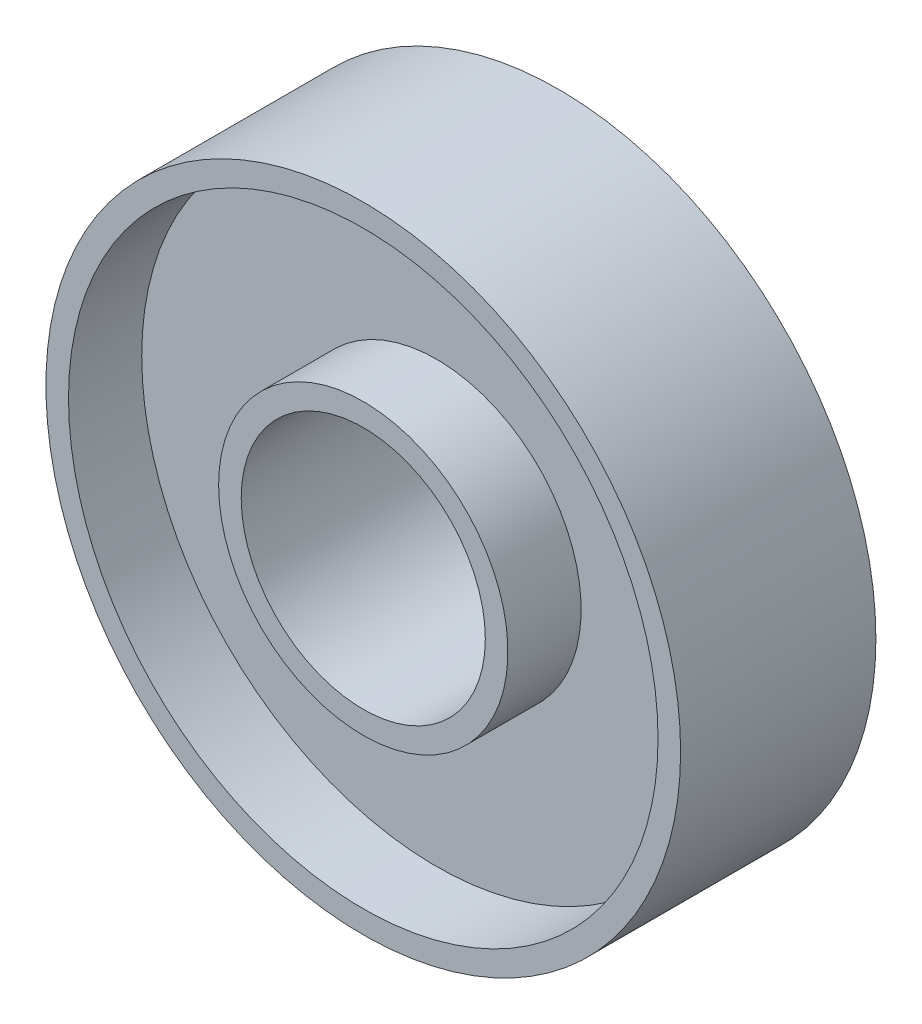
from build123d import *

# Parameters (mm, degrees)
SKETCH2_R                = 13
SKETCH2_R_2              = 12.075
BOSS_EXTRUDE1_DEPTH      = 8
BOSS_EXTRUDE2_DEPTH      = 1
BOSS_EXTRUDE2_DEPTH_BACK = 1
SKETCH3_R                = 12.569499656
BOSS_EXTRUDE3_DEPTH      = 4
BOSS_EXTRUDE3_DEPTH_BACK = 4
SKETCH5_R                = 5.925
SKETCH5_R_2              = 5
SKETCH6_R                = 5
CUT_EXTRUDE1_DEPTH       = 2


with BuildPart() as part:
    # Sketch2 → Boss-Extrude1 (new body)
    with BuildSketch(Plane.XY):
        Circle(SKETCH2_R)
        Circle(SKETCH2_R_2, mode=Mode.SUBTRACT)
    extrude(amount=BOSS_EXTRUDE1_DEPTH)

    # Sketch3 → Boss-Extrude2 (add, two sides: drawn at the far end of the back side and taken through both)
    with BuildSketch(Plane(origin=(0, 0, 4), x_dir=(-1, 0, 0), z_dir=(0, 0, -1)).offset(-BOSS_EXTRUDE2_DEPTH_BACK)):
        Circle(SKETCH3_R)
    extrude(amount=BOSS_EXTRUDE2_DEPTH + BOSS_EXTRUDE2_DEPTH_BACK)

    # Sketch5 → Boss-Extrude3 (add, two sides: drawn at the far end of the back side and taken through both)
    with BuildSketch(Plane(origin=(0, 0, 4), x_dir=(-1, 0, 0), z_dir=(0, 0, -1)).offset(-BOSS_EXTRUDE3_DEPTH_BACK)):
        Circle(SKETCH5_R)
        Circle(SKETCH5_R_2, mode=Mode.SUBTRACT)
    extrude(amount=BOSS_EXTRUDE3_DEPTH + BOSS_EXTRUDE3_DEPTH_BACK)

    # Sketch6 → Cut-Extrude1 (cut)
    with BuildSketch(Plane.XY.offset(5)):
        with Locations(Location((0, 0, 0), (0, 0, 180))):
            Circle(SKETCH6_R)
    extrude(amount=-CUT_EXTRUDE1_DEPTH, mode=Mode.SUBTRACT)


solid = part.part
